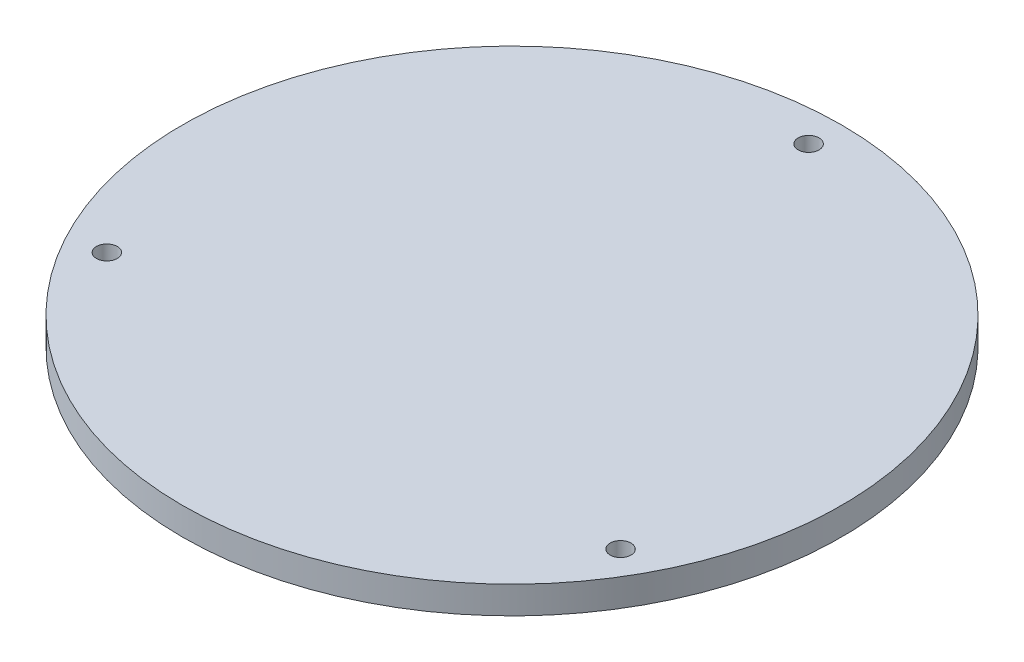
from build123d import *

# Parameters (mm, degrees)
SKETCH2_R           = 76.2
SKETCH2_R_2         = 2.0828
SKETCH2_R_3         = 2.413
SKETCH2_R_4         = 50.8
BOSS_EXTRUDE1_DEPTH = 6.35
SKETCH3_R           = 59.917719959
BOSS_EXTRUDE2_DEPTH = 6.35


with BuildPart() as part:
    # Sketch2 → Boss-Extrude1 (new body)
    with BuildSketch(Plane(origin=(0, 0, 0), x_dir=(1, 0, 0), z_dir=(0, 1, 0))):
        with Locations(Location((0, 0, 0), (0, 0, 270))):
            Circle(SKETCH2_R)
        with Locations(Location((-14.199848091, 52.994554534, 0), (0, 0, 270))):
            Circle(SKETCH2_R_2, mode=Mode.SUBTRACT)
        with Locations(Location((-38.794706443, 38.794706443, 0), (0, 0, 270))):
            Circle(SKETCH2_R_2, mode=Mode.SUBTRACT)
        with Locations(Location((-52.994554534, 14.199848091, 0), (0, 0, 270))):
            Circle(SKETCH2_R_2, mode=Mode.SUBTRACT)
        with Locations(Location((-52.994554534, -14.199848091, 0), (0, 0, 270))):
            Circle(SKETCH2_R_2, mode=Mode.SUBTRACT)
        with Locations(Location((-38.794706443, -38.794706443, 0), (0, 0, 270))):
            Circle(SKETCH2_R_2, mode=Mode.SUBTRACT)
        with Locations(Location((-14.199848091, -52.994554534, 0), (0, 0, 270))):
            Circle(SKETCH2_R_2, mode=Mode.SUBTRACT)
        with Locations(Location((14.199848091, -52.994554534, 0), (0, 0, 270))):
            Circle(SKETCH2_R_2, mode=Mode.SUBTRACT)
        with Locations(Location((38.794706443, -38.794706443, 0), (0, 0, 270))):
            Circle(SKETCH2_R_2, mode=Mode.SUBTRACT)
        with Locations(Location((52.994554534, -14.199848091, 0), (0, 0, 270))):
            Circle(SKETCH2_R_2, mode=Mode.SUBTRACT)
        with Locations(Location((52.994554534, 14.199848091, 0), (0, 0, 270))):
            Circle(SKETCH2_R_2, mode=Mode.SUBTRACT)
        with Locations(Location((38.794706443, 38.794706443, 0), (0, 0, 270))):
            Circle(SKETCH2_R_2, mode=Mode.SUBTRACT)
        with Locations(Location((14.199848091, 52.994554534, 0), (0, 0, 270))):
            Circle(SKETCH2_R_2, mode=Mode.SUBTRACT)
        with Locations(Location((-59.392022192, -34.29, 0), (0, 0, 270))):
            Circle(SKETCH2_R_3, mode=Mode.SUBTRACT)
        with Locations(Location((59.392022192, -34.29, 0), (0, 0, 270))):
            Circle(SKETCH2_R_3, mode=Mode.SUBTRACT)
        with Locations(Location((0, 68.58, 0), (0, 0, 270))):
            Circle(SKETCH2_R_3, mode=Mode.SUBTRACT)
        with Locations(Location((0, 0, 0), (0, 0, 270))):
            Circle(SKETCH2_R_4, mode=Mode.SUBTRACT)
    extrude(amount=BOSS_EXTRUDE1_DEPTH)

    # Sketch3 → Boss-Extrude2 (add, through all)
    with BuildSketch(Plane(origin=(0, 0, 0), x_dir=(1, 0, 0), z_dir=(0, 1, 0))):
        Circle(SKETCH3_R)
    extrude(amount=BOSS_EXTRUDE2_DEPTH)


solid = part.part
